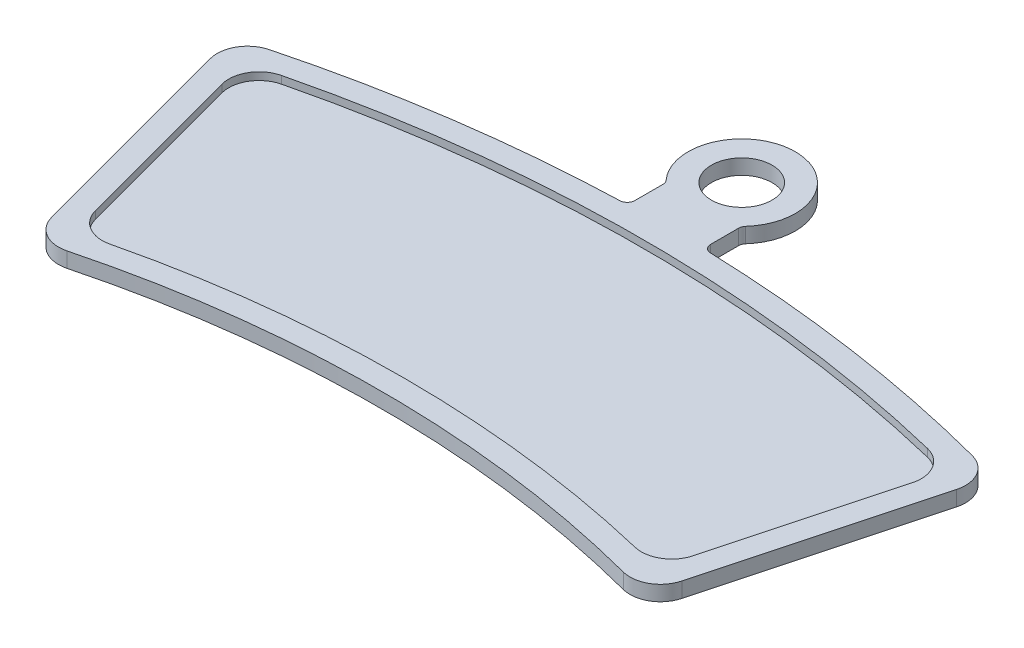
from build123d import *

# Parameters (mm, degrees)
BOSS_EXTRUDE1_DEPTH   = 1
CUT_EXTRUDE2_DEPTH    = 0.5
FILLET2_R             = 2
FILLET3_R             = 0.5
F_4_0MM_DOWEL_HOLE1_D = 4


with BuildPart() as part:
    # Sketch1 → Boss-Extrude1 (new body)
    with BuildSketch(Plane(origin=(0, 0, 0), x_dir=(1, 0, 0), z_dir=(0, 1, 0))):
        with BuildLine():
            Line((-25.127648951, 87.982107603), (-20.261027783, 69.819630142))
            ThreePointArc((-20.261027783, 69.819630142), (0, 72.7), (20.261027783, 69.819630142))
            Line((20.261027783, 69.819630142), (25.127648951, 87.982107603))
            ThreePointArc((25.127648951, 87.982107603), (13.92309714, 90.434492126), (2.499766704, 91.465846995))
            Line((2.499766704, 91.465846995), (2.499766704, 94))
            ThreePointArc((2.499766704, 94), (0.000164965, 100.03536894), (-2.5, 94.000233296))
            Line((-2.5, 94.000233296), (-2.5, 91.465840618))
            ThreePointArc((-2.5, 91.465840618), (-13.923212473, 90.434474369), (-25.127648951, 87.982107603))
        make_face()
    extrude(amount=BOSS_EXTRUDE1_DEPTH)

    # Sketch2 → Cut-Extrude2 (cut)
    with BuildSketch(Plane(origin=(0, 1, 0), x_dir=(1, 0, 0), z_dir=(0, 1, 0))):
        with BuildLine():
            Line((19.204373147, 71.671696311), (23.293714059, 86.933324366))
            ThreePointArc((23.293714059, 86.933324366), (0, 90), (-23.293714059, 86.933324366))
            Line((-23.293714059, 86.933324366), (-19.204373147, 71.671696311))
            ThreePointArc((-19.204373147, 71.671696311), (0, 74.2), (19.204373147, 71.671696311))
        make_face()
    extrude(amount=-CUT_EXTRUDE2_DEPTH, mode=Mode.SUBTRACT)

    # Fillet2
    fillet2_edges = [part.edges().sort_by_distance(p)[0] for p in [
        (25.127648951, 0.5, -87.982107603),
        (20.261027783, 0.5, -69.819630142),
        (-20.261027783, 0.5, -69.819630142),
        (-25.127648951, 0.5, -87.982107603),
        (19.204373147, 0.75, -71.671696311),
        (-19.204373147, 0.75, -71.671696311),
        (-23.293714059, 0.75, -86.933324366),
        (23.293714059, 0.75, -86.933324366),
    ]]
    fillet(fillet2_edges, radius=FILLET2_R)

    # Fillet3
    fillet3_edges = [part.edges().sort_by_distance(p)[0] for p in [
        (-2.5, 0.5, -91.465840618),
        (-2.5, 0.5, -94.000233296),
        (2.499766704, 0.5, -94),
        (2.499766704, 0.5, -91.465846995),
    ]]
    fillet(fillet3_edges, radius=FILLET3_R)

    # Ø4.0mm Dowel Hole1 (through all)
    with Locations(Plane(origin=(0, 1, 0), x_dir=(1, 0, 0), z_dir=(0, 1, 0))):
        with Locations((0, 96.5)):
            Hole(F_4_0MM_DOWEL_HOLE1_D / 2)


solid = part.part
